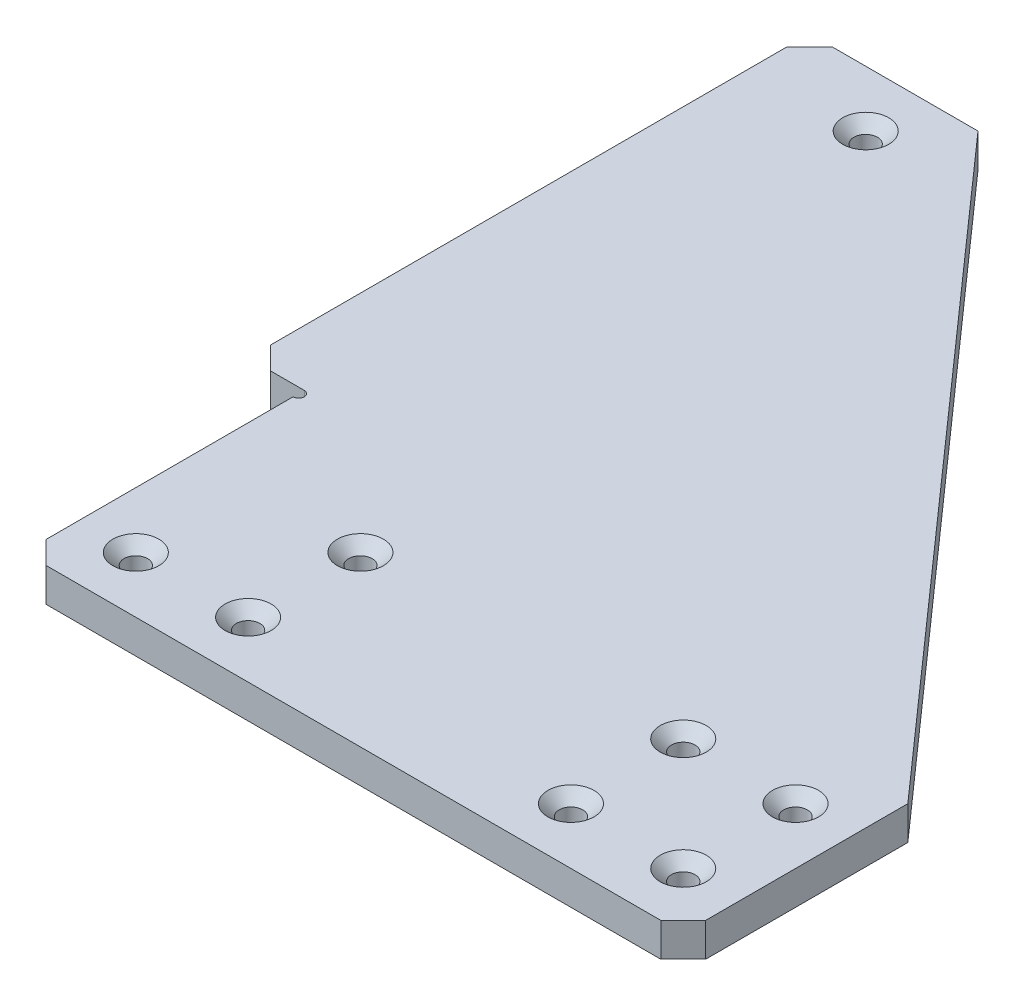
from build123d import *

# Parameters (mm, degrees)
SKETCH_1_R          = 2.1
EXTRUDE_1_DEPTH     = 3
SKETCH_2_R          = 1
CUT_EXTRUDE_1_DEPTH = 166.113786523
CHAMFER_1_SIZE      = 4
CHAMFER_2_SIZE      = 2


with BuildPart() as part:
    # 草图1 → 凸台-拉伸1 (new, symmetric)
    with BuildSketch(Plane(origin=(0, 0, 0), x_dir=(1, 0, 0), z_dir=(0, 1, 0))):
        Polygon((-68.75, 150), (-68.75, 50), (-58.75, 50), (-58.75, 0), (58.75, 0), (58.75, 40), (-38.75, 150), align=None)
        with Locations(Location((-48.75, 140, 0), (0, 0, 270))):
            Circle(SKETCH_1_R, mode=Mode.SUBTRACT)
        with Locations(Location((-48.75, 10, 0), (0, 0, 270))):
            Circle(SKETCH_1_R, mode=Mode.SUBTRACT)
        with Locations(Location((-28.75, 30, 0), (0, 0, 270))):
            Circle(SKETCH_1_R, mode=Mode.SUBTRACT)
        with Locations(Location((28.75, 30, 0), (0, 0, 270))):
            Circle(SKETCH_1_R, mode=Mode.SUBTRACT)
        with Locations(Location((-28.75, 10, 0), (0, 0, 270))):
            Circle(SKETCH_1_R, mode=Mode.SUBTRACT)
        with Locations(Location((28.75, 10, 0), (0, 0, 270))):
            Circle(SKETCH_1_R, mode=Mode.SUBTRACT)
        with Locations(Location((48.75, 30, 0), (0, 0, 270))):
            Circle(SKETCH_1_R, mode=Mode.SUBTRACT)
        with Locations(Location((48.75, 10, 0), (0, 0, 270))):
            Circle(SKETCH_1_R, mode=Mode.SUBTRACT)
    extrude(amount=EXTRUDE_1_DEPTH, both=True)

    # 草图2 → 切除-拉伸1 (cut, through all)
    with BuildSketch(Plane(origin=(0, 3, 0), x_dir=(1, 0, 0), z_dir=(0, 1, 0))):
        with Locations((-58.75, 49)):
            Circle(SKETCH_2_R)
    extrude(amount=-CUT_EXTRUDE_1_DEPTH, mode=Mode.SUBTRACT)

    # 倒角1
    chamfer_1_edges = [part.edges().sort_by_distance(p)[0] for p in [
        (58.75, 0, 0),
        (-58.75, 0, 0),
        (-68.75, 0, -50),
        (-68.75, 0, -150),
    ]]
    chamfer(chamfer_1_edges, length=CHAMFER_1_SIZE)

    # 倒角2
    chamfer_2_edges = [part.edges().sort_by_distance(p)[0] for p in [
        (-48.75, 3, -142.1),
        (-28.75, 3, -32.1),
        (-48.75, 3, -12.1),
        (28.75, 3, -32.1),
        (-28.75, 3, -12.1),
        (28.75, 3, -12.1),
        (48.75, 3, -12.1),
        (48.75, 3, -32.1),
    ]]
    chamfer(chamfer_2_edges, length=CHAMFER_2_SIZE)


solid = part.part
